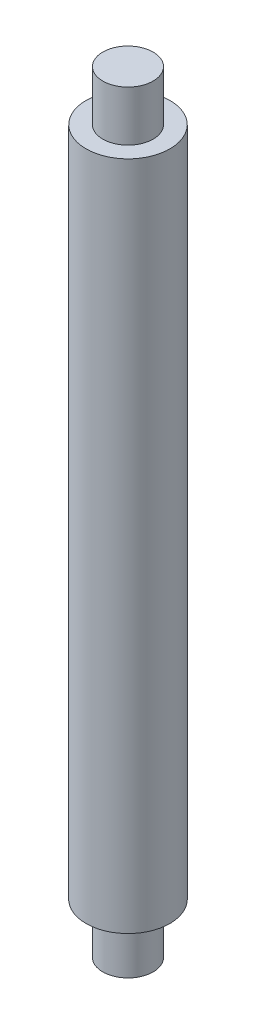
from build123d import *

# Parameters (mm, degrees)
SKETCH_1_R      = 2.5
EXTRUDE_2_DEPTH = 20
SKETCH_2_R      = 1.5
EXTRUDE_3_DEPTH = 3
EXTRUDE_START   = 3
SKETCH_3_R      = 1.5
EXTRUDE_4_DEPTH = 3


with BuildPart() as part:
    # 草图1 → 凸台-拉伸2 (new, symmetric)
    with BuildSketch(Plane(origin=(0, 0, 0), x_dir=(1, 0, 0), z_dir=(0, 1, 0))):
        with Locations(Location((0, 0, 0), (0, 0, 270))):
            Circle(SKETCH_1_R)
    extrude(amount=EXTRUDE_2_DEPTH, both=True)

    # 草图2 → 凸台-拉伸3 (add)
    with BuildSketch(Plane(origin=(0, 20, 0), x_dir=(1, 0, 0), z_dir=(0, 1, 0))):
        with Locations(Location((0, 0, 0), (0, 0, 270))):
            Circle(SKETCH_2_R)
    extrude(amount=EXTRUDE_3_DEPTH)

    # 草图3 → 凸台-拉伸4 (add)
    with BuildSketch(Plane.XZ.offset(20).offset(EXTRUDE_START)):
        with Locations(Location((0, 0, 0), (0, 0, 90))):
            Circle(SKETCH_3_R)
    extrude(amount=-EXTRUDE_4_DEPTH)


solid = part.part
